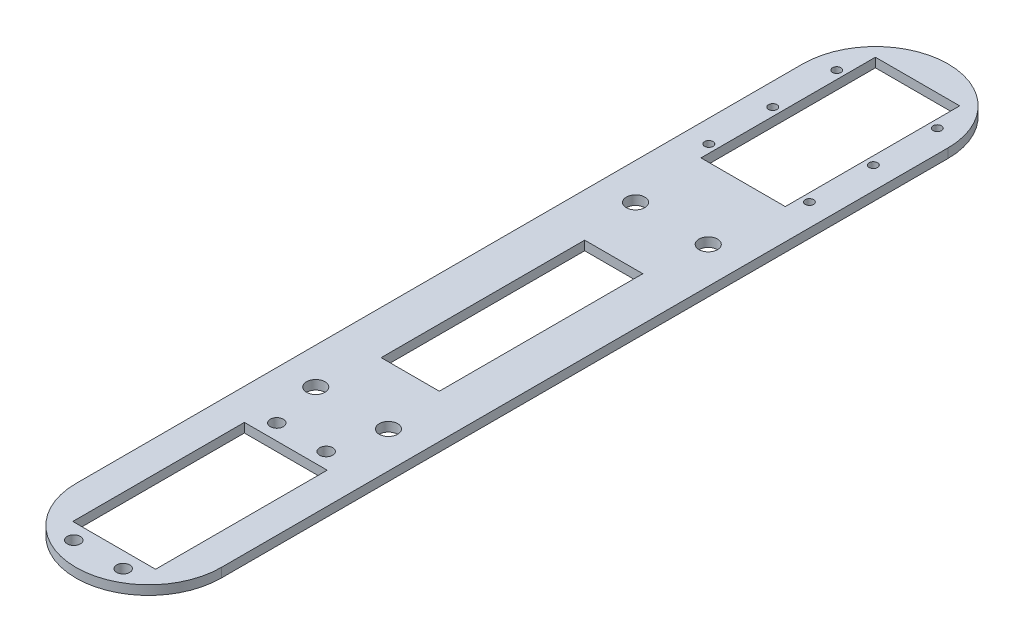
from build123d import *

# Parameters (mm, degrees)
SKETCH2_W              = 50
SKETCH2_H              = 300
BOSS_EXTRUDE1_DEPTH    = 3.175
SKETCH3_R              = 1.025
SKETCH3_R_2            = 2.25
SKETCH3_W              = 29
SKETCH3_H              = 60
SKETCH3_W_2            = 28.48
SKETCH3_H_2            = 59.03
CUT_EXTRUDE1_DEPTH     = 6.35
CUT_EXTRUDE2_DEPTH     = 6.35
SKETCH5_R              = 3.175
SKETCH5_W              = 20
SKETCH5_H              = 70
CUT_EXTRUDE3_DEPTH     = 6.35
M2_5_CLEARANCE_HOLE1_D = 2.9


with BuildPart() as part:
    # Sketch2 → Boss-Extrude1 (new body)
    with BuildSketch(Plane(origin=(0, 0, 0), x_dir=(1, 0, 0), z_dir=(0, 1, 0))):
        with Locations((25, -150)):
            Rectangle(SKETCH2_W, SKETCH2_H)
    extrude(amount=BOSS_EXTRUDE1_DEPTH)

    # Sketch3 → Cut-Extrude1 (cut)
    with BuildSketch(Plane(origin=(0, 3.175, 0), x_dir=(1, 0, 0), z_dir=(0, 1, 0))):
        with Locations(Location((7.7, -21, 0), (0, 0, 270))):
            Circle(SKETCH3_R)
        with Locations(Location((7.7, -43, 0), (0, 0, 270))):
            Circle(SKETCH3_R)
        with Locations(Location((7.7, -65, 0), (0, 0, 270))):
            Circle(SKETCH3_R)
        with Locations(Location((42.3, -65, 0), (0, 0, 270))):
            Circle(SKETCH3_R)
        with Locations(Location((42.3, -43, 0), (0, 0, 270))):
            Circle(SKETCH3_R)
        with Locations(Location((42.3, -21, 0), (0, 0, 270))):
            Circle(SKETCH3_R)
        with Locations(Location((16.5, -292.24, 0), (0, 0, 270))):
            Circle(SKETCH3_R_2)
        with Locations(Location((33.5, -292.24, 0), (0, 0, 270))):
            Circle(SKETCH3_R_2)
        with Locations(Location((16.5, -222.41, 0), (0, 0, 270))):
            Circle(SKETCH3_R_2)
        with Locations(Location((33.5, -222.41, 0), (0, 0, 270))):
            Circle(SKETCH3_R_2)
        with Locations((25, -40.5)):
            Rectangle(SKETCH3_W, SKETCH3_H)
        with Locations((25, -257.325)):
            Rectangle(SKETCH3_W_2, SKETCH3_H_2)
    extrude(amount=-CUT_EXTRUDE1_DEPTH, mode=Mode.SUBTRACT)

    # Sketch4 → Cut-Extrude2 (cut)
    with BuildSketch(Plane(origin=(0, 3.175, 0), x_dir=(1, 0, 0), z_dir=(0, 1, 0))):
        with BuildLine():
            Line((0, 0), (0, -25))
            ThreePointArc((0, -25), (7.32233047, -7.32233047), (25, 0))
            Line((25, 0), (0, 0))
        make_face()
        with BuildLine():
            ThreePointArc((25, 0), (42.67766953, -7.32233047), (50, -25))
            Line((50, -25), (50, 0))
            Line((50, 0), (25, 0))
        make_face()
        with BuildLine():
            ThreePointArc((25, -300), (7.32233047, -292.67766953), (0, -275))
            Line((0, -275), (0, -300))
            Line((0, -300), (25, -300))
        make_face()
        with BuildLine():
            Line((50, -300), (50, -275))
            ThreePointArc((50, -275), (42.67766953, -292.67766953), (25, -300))
            Line((25, -300), (50, -300))
        make_face()
    extrude(amount=-CUT_EXTRUDE2_DEPTH, mode=Mode.SUBTRACT)

    # Sketch5 → Cut-Extrude3 (cut)
    with BuildSketch(Plane.XZ):
        with Locations(Location((12.5, 205, 0), (0, 0, 270))):
            Circle(SKETCH5_R)
        with Locations(Location((12.5, 95, 0), (0, 0, 90))):
            Circle(SKETCH5_R)
        with Locations(Location((37.5, 95, 0), (0, 0, 270))):
            Circle(SKETCH5_R)
        with Locations(Location((37.5, 205, 0), (0, 0, 90))):
            Circle(SKETCH5_R)
        with Locations((25, 150)):
            Rectangle(SKETCH5_W, SKETCH5_H)
    extrude(amount=-CUT_EXTRUDE3_DEPTH, mode=Mode.SUBTRACT)

    # M2.5 Clearance Hole1 (through all)
    with Locations(Plane(origin=(0, 0, 0), x_dir=(-1, 0, 0), z_dir=(0, -1, 0))):
        with Locations((-7.7, -65), (-42.3, -65), (-7.7, -43), (-42.3, -43), (-42.3, -21), (-7.7, -21)):
            Hole(M2_5_CLEARANCE_HOLE1_D / 2)


solid = part.part
